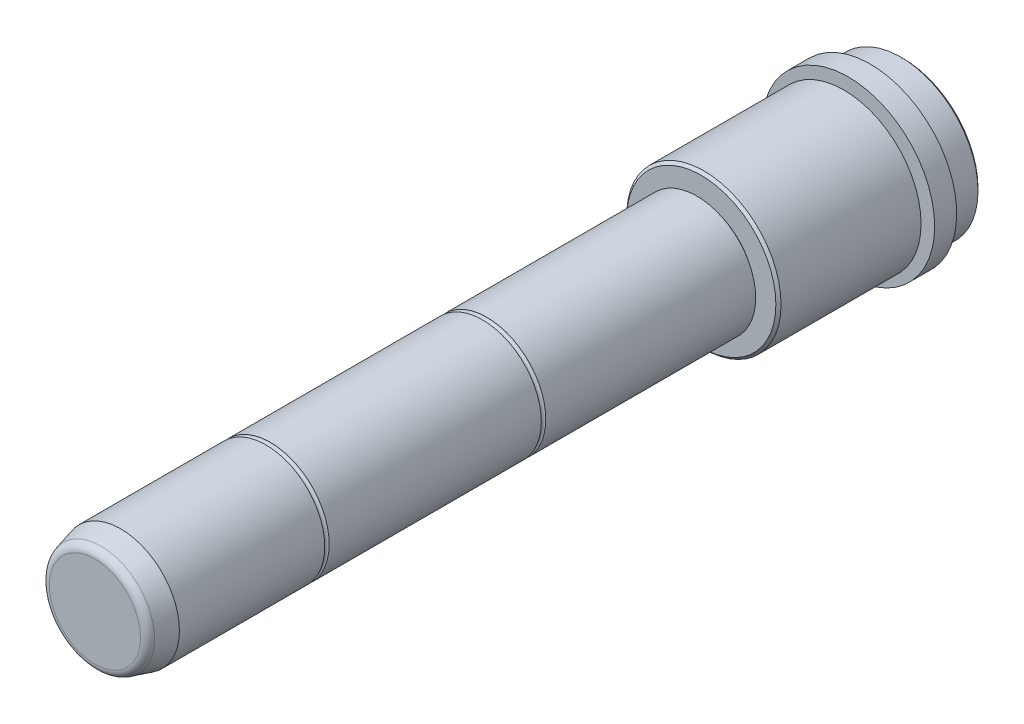
from build123d import *

# Parameters (mm, degrees)
SZKIC1_W = 9
SZKIC1_H = 21
SZKIC3_W = 1.2
SZKIC3_H = 2.1
SZKIC4_W = 6
SZKIC4_H = 23.5
SZKIC5_W = 40
SZKIC5_H = 21
SZKIC6_W = 1.2
SZKIC6_H = 2.1
SZKIC8_W = 165
SZKIC8_H = 16
SZKIC9_W = 1.2
SZKIC9_H = 1.6


with BuildPart() as part:
    # Szkic1 → Obrót1 (revolve)
    with BuildSketch(Plane(origin=(0, 0, 0), x_dir=(0, 0, -1), z_dir=(1, 0, 0)), mode=Mode.PRIVATE) as obr_t1_sk:
        with Locations((-4.5, 10.5)):
            Rectangle(SZKIC1_W, SZKIC1_H)
    revolve(obr_t1_sk.sketch.rotate(Axis((0, 0, 0), (0, 0, 1)), 270), axis=Axis((0, 0, 0), (0, 0, 1)))

    # Szkic2 → Wycięcie-obrót1 (revolve, cut)
    with BuildSketch(Plane(origin=(0, 0, 0), x_dir=(0, 0, -1), z_dir=(1, 0, 0)), mode=Mode.PRIVATE) as wyci_cie_obr_t1_sk:
        Polygon((-0.707106781, 21), (0, 20.292893219), (0, 21), align=None)
    revolve(wyci_cie_obr_t1_sk.sketch.rotate(Axis((0, 0, 0), (0, 0, 1)), 270), axis=Axis((0, 0, 0), (0, 0, 1)), mode=Mode.SUBTRACT)

    # Szkic3 → Wycięcie-obrót2 (revolve, cut)
    with BuildSketch(Plane(origin=(0, 0, 0), x_dir=(0, 0, -1), z_dir=(1, 0, 0)), mode=Mode.PRIVATE) as wyci_cie_obr_t2_sk:
        with Locations((-8.4, 19.95)):
            Rectangle(SZKIC3_W, SZKIC3_H)
    revolve(wyci_cie_obr_t2_sk.sketch.rotate(Axis((0, 0, 0), (0, 0, 1)), 270), axis=Axis((0, 0, 0), (0, 0, 1)), mode=Mode.SUBTRACT)

    # Szkic4 → Obrót2 (revolve)
    with BuildSketch(Plane(origin=(0, 0, 0), x_dir=(0, 0, -1), z_dir=(1, 0, 0)), mode=Mode.PRIVATE) as obr_t2_sk:
        with Locations((-12, 11.75)):
            Rectangle(SZKIC4_W, SZKIC4_H)
    revolve(obr_t2_sk.sketch.rotate(Axis((0, 0, 9), (0, 0, 1)), 270), axis=Axis((0, 0, 9), (0, 0, 1)))

    # Szkic5 → Obrót3 (revolve)
    with BuildSketch(Plane(origin=(0, 0, 0), x_dir=(0, 0, -1), z_dir=(1, 0, 0)), mode=Mode.PRIVATE) as obr_t3_sk:
        with Locations((-35, 10.5)):
            Rectangle(SZKIC5_W, SZKIC5_H)
    revolve(obr_t3_sk.sketch.rotate(Axis((0, 0, 15), (0, 0, 1)), 270), axis=Axis((0, 0, 15), (0, 0, 1)))

    # Szkic6 → Wycięcie-obrót3 (revolve, cut)
    with BuildSketch(Plane(origin=(0, 0, 0), x_dir=(0, 0, -1), z_dir=(1, 0, 0)), mode=Mode.PRIVATE) as wyci_cie_obr_t3_sk:
        with Locations((-15.6, 19.95)):
            Rectangle(SZKIC6_W, SZKIC6_H)
    revolve(wyci_cie_obr_t3_sk.sketch.rotate(Axis((0, 0, 15), (0, 0, 1)), 270), axis=Axis((0, 0, 15), (0, 0, 1)), mode=Mode.SUBTRACT)

    # Szkic7 → Wycięcie-obrót4 (revolve, cut)
    with BuildSketch(Plane(origin=(0, 0, 0), x_dir=(0, 0, -1), z_dir=(1, 0, 0)), mode=Mode.PRIVATE) as wyci_cie_obr_t4_sk:
        Polygon((-55, 20.292893219), (-54.292893219, 21), (-55, 21), align=None)
    revolve(wyci_cie_obr_t4_sk.sketch.rotate(Axis((0, 0, 9), (0, 0, 1)), 270), axis=Axis((0, 0, 9), (0, 0, 1)), mode=Mode.SUBTRACT)

    # Szkic8 → Obrót4 (revolve)
    with BuildSketch(Plane(origin=(0, 0, 0), x_dir=(0, 0, -1), z_dir=(1, 0, 0)), mode=Mode.PRIVATE) as obr_t4_sk:
        with Locations((-137.5, 8)):
            Rectangle(SZKIC8_W, SZKIC8_H)
    revolve(obr_t4_sk.sketch.rotate(Axis((0, 0, 55), (0, 0, 1)), 270), axis=Axis((0, 0, 55), (0, 0, 1)))

    # Szkic9 → Wycięcie-obrót5 (revolve, cut)
    with BuildSketch(Plane(origin=(0, 0, 0), x_dir=(0, 0, -1), z_dir=(1, 0, 0)), mode=Mode.PRIVATE) as wyci_cie_obr_t5_sk:
        with Locations((-55.6, 15.2)):
            Rectangle(SZKIC9_W, SZKIC9_H)
    revolve(wyci_cie_obr_t5_sk.sketch.rotate(Axis((0, 0, 55), (0, 0, 1)), 270), axis=Axis((0, 0, 55), (0, 0, 1)), mode=Mode.SUBTRACT)

    # Szkic10 → Wycięcie-obrót6 (revolve, cut)
    with BuildSketch(Plane(origin=(0, 0, 0), x_dir=(0, 0, -1), z_dir=(1, 0, 0)), mode=Mode.PRIVATE) as wyci_cie_obr_t6_sk:
        Polygon((-220, 14.124355653), (-213, 16), (-220, 16), align=None)
    revolve(wyci_cie_obr_t6_sk.sketch.rotate(Axis((0, 0, 55), (0, 0, 1)), 270), axis=Axis((0, 0, 55), (0, 0, 1)), mode=Mode.SUBTRACT)

    # Szkic11 → Wycięcie-obrót7 (revolve, cut)
    with BuildSketch(Plane(origin=(0, 0, 0), x_dir=(0, 0, -1), z_dir=(1, 0, 0)), mode=Mode.PRIVATE) as wyci_cie_obr_t7_sk:
        with BuildLine():
            Line((-218.332342851, 14.571203039), (-220, 14.124355653))
            Line((-220, 14.124355653), (-220, 12.39786993))
            ThreePointArc((-220, 12.39786993), (-219.535045016, 13.767583145), (-218.332342851, 14.571203039))
        make_face()
    revolve(wyci_cie_obr_t7_sk.sketch.rotate(Axis((0, 0, 55), (0, 0, 1)), 270), axis=Axis((0, 0, 55), (0, 0, 1)), mode=Mode.SUBTRACT)

    # Szkic12 → Wycięcie-obrót8 (revolve, cut)
    with BuildSketch(Plane(origin=(0, 0, 0), x_dir=(0, 0, -1), z_dir=(1, 0, 0)), mode=Mode.PRIVATE) as wyci_cie_obr_t8_sk:
        with BuildLine():
            Line((-172.257142857, 16), (-173.457142857, 16))
            ThreePointArc((-173.457142857, 16), (-172.857142857, 15.4), (-172.257142857, 16))
        make_face()
    revolve(wyci_cie_obr_t8_sk.sketch.rotate(Axis((0, 0, 172.257142857), (0, 0, 1)), 270), axis=Axis((0, 0, 172.257142857), (0, 0, 1)), mode=Mode.SUBTRACT)

    # Szkic13 → Wycięcie-obrót9 (revolve, cut)
    with BuildSketch(Plane(origin=(0, 0, 0), x_dir=(0, 0, -1), z_dir=(1, 0, 0)), mode=Mode.PRIVATE) as wyci_cie_obr_t9_sk:
        with BuildLine():
            Line((-113.328570957, 16), (-114.528570957, 16))
            ThreePointArc((-114.528570957, 16), (-113.928570957, 15.4), (-113.328570957, 16))
        make_face()
    revolve(wyci_cie_obr_t9_sk.sketch.rotate(Axis((0, 0, 113.328570957), (0, 0, 1)), 270), axis=Axis((0, 0, 113.328570957), (0, 0, 1)), mode=Mode.SUBTRACT)


solid = part.part
